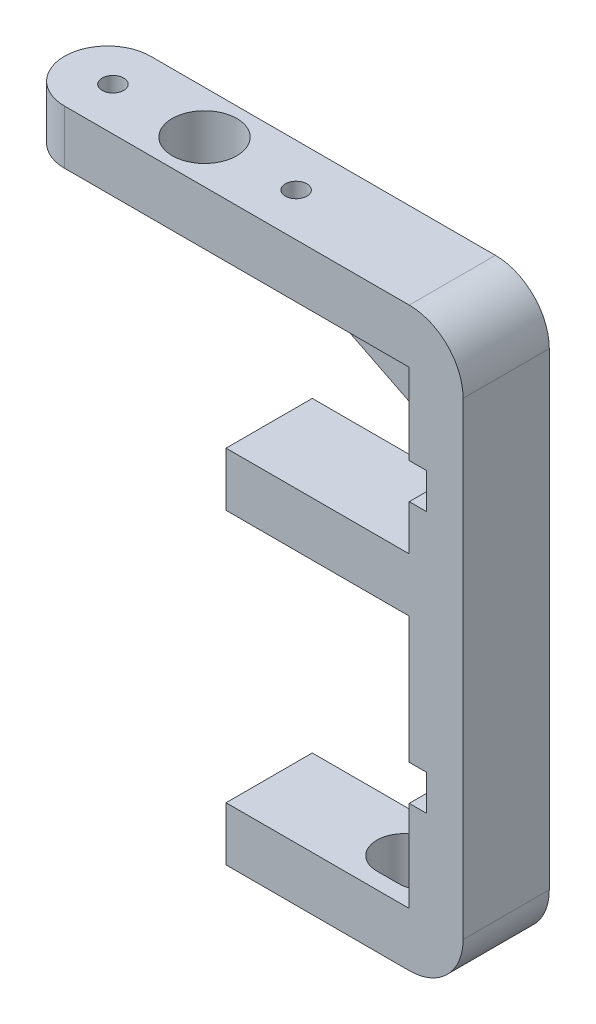
from build123d import *

# Parameters (mm, degrees)
BOSS_EXTRUDE1_DEPTH = 20
BOSS_EXTRUDE2_DEPTH = 25
SKETCH3_R           = 15
SKETCH3_R_2         = 5
CUT_EXTRUDE1_DEPTH  = 25
FILLET1_R           = 25
SKETCH4_R           = 6
CUT_EXTRUDE2_DEPTH  = 40
SKETCH5_W           = 40
SKETCH5_H           = 16.5
CUT_EXTRUDE3_DEPTH  = 8
RIB1_REACH          = 339.611
SKETCH6_WALL_W      = 733.123885092
SKETCH6_WALL_H      = 25
CUT_EXTRUDE4_DEPTH  = 25
SKETCH8_W           = 9
SKETCH8_H           = 24
CUT_EXTRUDE5_DEPTH  = 8


with BuildPart() as part:
    # Sketch1 → Boss-Extrude1 (new, symmetric)
    with BuildSketch(Plane.XY):
        Polygon((-185, 0), (0, 0), (0, -267.5), (-110, -267.5), (-110, -242.5), (-25, -242.5), (-25, -125), (-110, -125), (-110, -100), (-25, -100), (-25, -25), (-185, -25), align=None)
    extrude(amount=BOSS_EXTRUDE1_DEPTH, both=True)

    # Sketch2 → Boss-Extrude2 (add)
    with BuildSketch(Plane(origin=(0, 0, 0), x_dir=(1, 0, 0), z_dir=(0, 1, 0))):
        with BuildLine():
            Line((-185, 20), (-185, -20))
            ThreePointArc((-185, -20), (-205, 0), (-185, 20))
        make_face()
    extrude(amount=-BOSS_EXTRUDE2_DEPTH)

    # Sketch3 → Cut-Extrude1 (cut)
    with BuildSketch(Plane(origin=(0, 0, 0), x_dir=(1, 0, 0), z_dir=(0, 1, 0))):
        with Locations(Location((-140, 0, 0), (0, 0, 180))):
            Circle(SKETCH3_R)
        with Locations(Location((-182.5, 0, 0), (0, 0, 180))):
            Circle(SKETCH3_R_2)
        with Locations(Location((-97.5, 0, 0), (0, 0, 180))):
            Circle(SKETCH3_R_2)
    extrude(amount=-CUT_EXTRUDE1_DEPTH, mode=Mode.SUBTRACT)

    # Fillet1
    fillet1_edges = [part.edges().sort_by_distance(p)[0] for p in [
        (0, 0, 0),
        (0, -267.5, 0),
    ]]
    fillet(fillet1_edges, radius=FILLET1_R)

    # Sketch4 → Cut-Extrude2 (cut)
    with BuildSketch(Plane.ZY.offset(110)):
        with Locations((0, -251.225)):
            Circle(SKETCH4_R)
        with Locations(Location((0, -116.275, 0), (0, 0, 180))):
            Circle(SKETCH4_R)
    extrude(amount=-CUT_EXTRUDE2_DEPTH, mode=Mode.SUBTRACT)

    # Sketch5 → Cut-Extrude3 (cut)
    with BuildSketch(Plane.ZY.offset(25)):
        with Locations((0, -70.75)):
            Rectangle(SKETCH5_W, SKETCH5_H)
        with Locations((0, -192)):
            Rectangle(SKETCH5_W, SKETCH5_H)
    extrude(amount=-CUT_EXTRUDE3_DEPTH, mode=Mode.SUBTRACT)

    # Sketch6 wall → Rib1 (add, up to next)
    with BuildSketch(Plane(origin=(-50, -37.5, 0), x_dir=(0.894427191, -0.4472135955, 0), z_dir=(0.4472135955, 0.894427191, 0)), mode=Mode.PRIVATE) as rib1_sk1:
        Rectangle(SKETCH6_WALL_W, SKETCH6_WALL_H)
    rib1_tool1 = extrude(rib1_sk1.sketch, amount=RIB1_REACH, mode=Mode.PRIVATE) - part.part
    add(rib1_tool1.solids().sort_by_distance((-50, -37.5, 0))[0])

    # Sketch7 → Cut-Extrude4 (cut)
    with BuildSketch(Plane.XZ.offset(267.5)):
        with BuildLine():
            Line((-47.5, 12.5), (-37.5, 12.5))
            ThreePointArc((-37.5, 12.5), (-25, 0), (-37.5, -12.5))
            Line((-37.5, -12.5), (-47.5, -12.5))
            ThreePointArc((-47.5, -12.5), (-60, 0), (-47.5, 12.5))
        make_face()
    extrude(amount=-CUT_EXTRUDE4_DEPTH, mode=Mode.SUBTRACT)

    # Sketch8 → Cut-Extrude5 (cut)
    with BuildSketch(Plane.XZ.offset(125)):
        with Locations((-42.5, 0)):
            Rectangle(SKETCH8_W, SKETCH8_H)
    extrude(amount=-CUT_EXTRUDE5_DEPTH, mode=Mode.SUBTRACT)


solid = part.part
